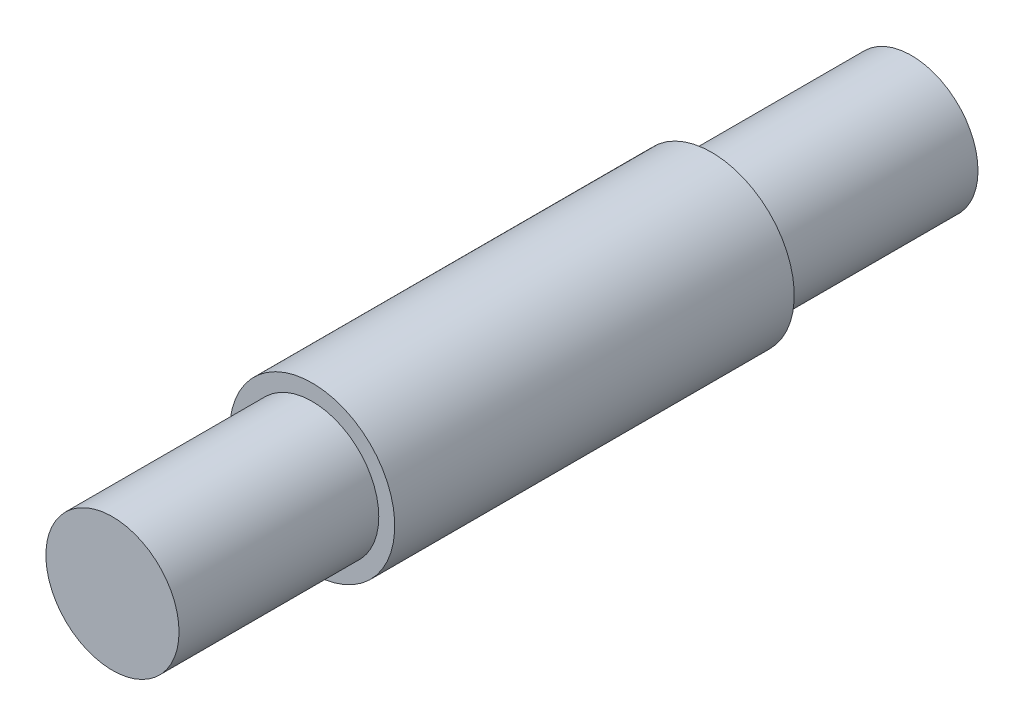
from build123d import *

# Parameters (mm, degrees)
SKETCH1_R                = 3.937
BOSS_EXTRUDE2_DEPTH      = 19.05
BOSS_EXTRUDE3_DEPTH      = 9.525
BOSS_EXTRUDE3_DEPTH_BACK = 28.575
SKETCH3_R                = 3.175


with BuildPart() as part:
    # Sketch1 → Boss-Extrude2 (new body)
    with BuildSketch(Plane.XY):
        with Locations(Location((0, 0, 0), (0, 0, 180))):
            Circle(SKETCH1_R)
    extrude(amount=BOSS_EXTRUDE2_DEPTH)

    # Sketch3 → Boss-Extrude3 (add, two sides: drawn at the far end of the back side and taken through both)
    with BuildSketch(Plane.XY.offset(19.05).offset(-BOSS_EXTRUDE3_DEPTH_BACK)):
        Circle(SKETCH3_R)
    extrude(amount=BOSS_EXTRUDE3_DEPTH + BOSS_EXTRUDE3_DEPTH_BACK)


solid = part.part
